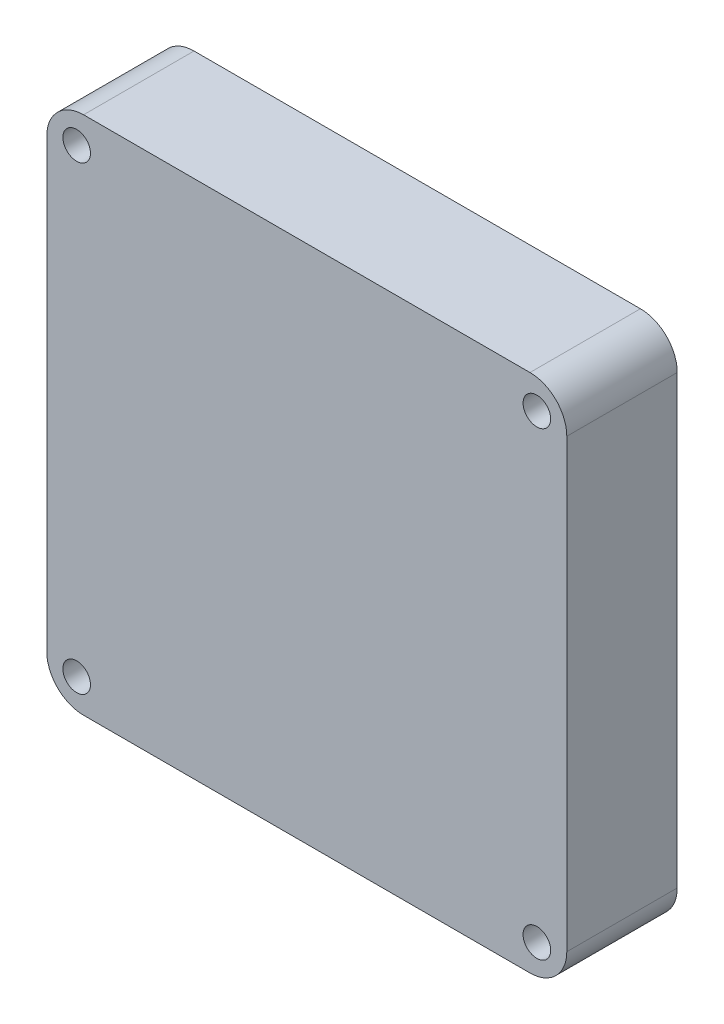
from build123d import *

# Parameters (mm, degrees)
SKETCH_1_W        = 56.5
SKETCH_1_H        = 56.5
SKETCH_1_R        = 1.5
EXTRUDE_447_DEPTH = 12
FILLET_1_R        = 4


with BuildPart() as part:
    # Эскиз1 → Extrude 447 (new body)
    with BuildSketch(Plane.XY):
        Rectangle(SKETCH_1_W, SKETCH_1_H)
        with Locations((-25, 25)):
            Circle(SKETCH_1_R, mode=Mode.SUBTRACT)
        with Locations((25, 25)):
            Circle(SKETCH_1_R, mode=Mode.SUBTRACT)
        with Locations((25, -25)):
            Circle(SKETCH_1_R, mode=Mode.SUBTRACT)
        with Locations((-25, -25)):
            Circle(SKETCH_1_R, mode=Mode.SUBTRACT)
    extrude(amount=EXTRUDE_447_DEPTH)

    # Скругление1
    fillet_1_edges = [part.edges().sort_by_distance(p)[0] for p in [
        (28.25, -28.25, 6),
        (-28.25, -28.25, 6),
        (-28.25, 28.25, 6),
        (28.25, 28.25, 6),
    ]]
    fillet(fillet_1_edges, radius=FILLET_1_R)


solid = part.part
